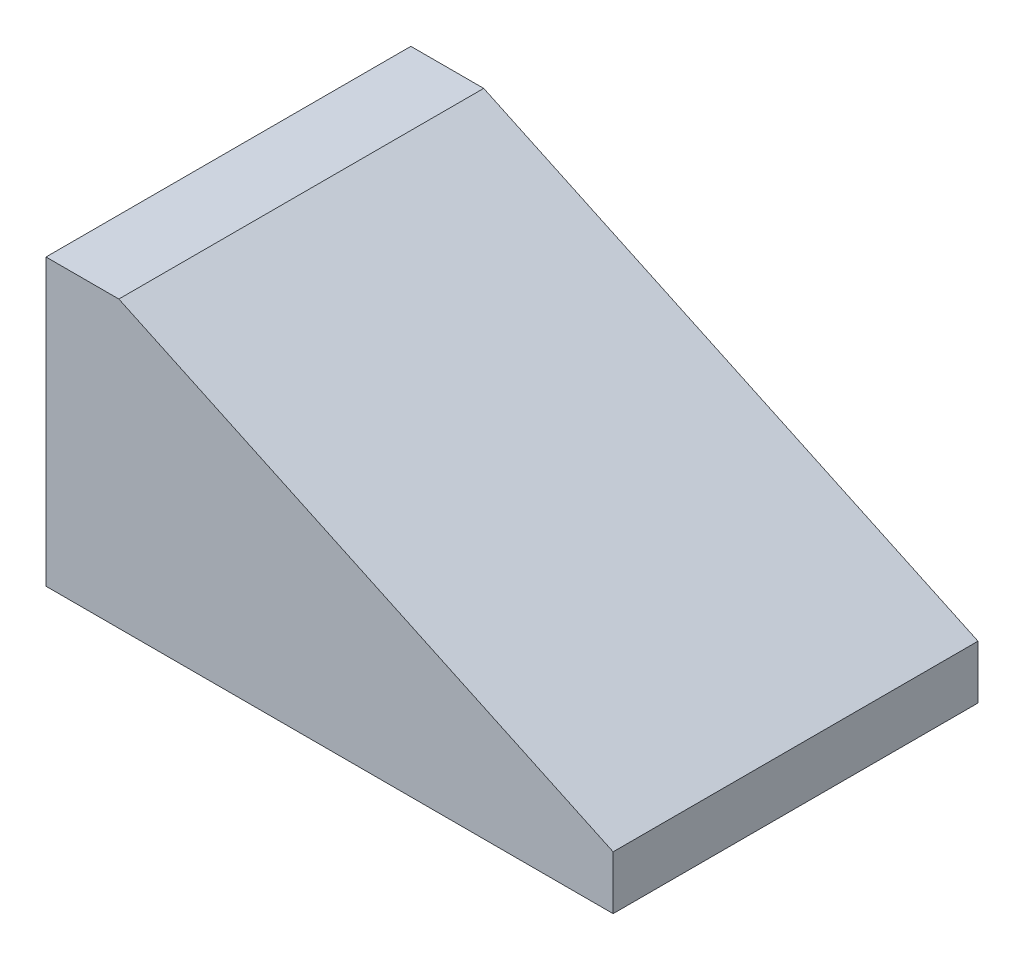
from build123d import *

# Parameters (mm, degrees)
EXTRUDE1_DEPTH = 56.134


with BuildPart() as part:
    # Sketch1 → Extrude1 (new body)
    with BuildSketch(Plane.XY):
        Polygon((0, 43.871305419), (0, 0), (87.250869818, 0), (87.250869818, 8.242487685), (11.207273759, 43.871305419), align=None)
    extrude(amount=-EXTRUDE1_DEPTH)


solid = part.part
